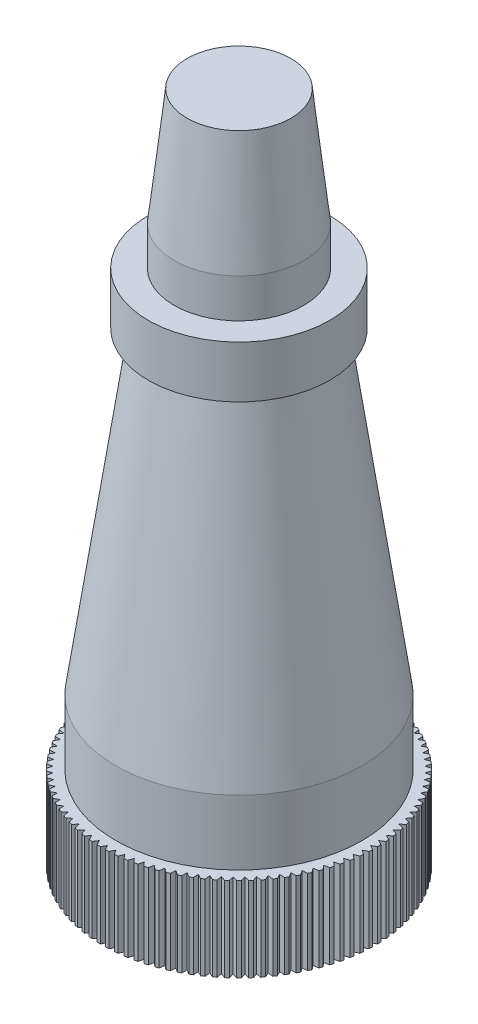
from build123d import *

# Parameters (mm, degrees)
SKETCH1_W          = 7
SKETCH1_H          = 2
CUT_EXTRUDE1_START = -10
SKETCH3_R          = 8.5
SKETCH3_R_2        = 7
CUT_EXTRUDE1_DEPTH = 10
CUT_EXTRUDE2_DEPTH = 6.5
CIRPATTERN1_COUNT  = 100


with BuildPart() as part:
    # Sketch1 → Revolve1 (revolve)
    with BuildSketch(Plane.XY):
        Polygon((0, 42), (0, 38), (6, 38), (7, 38), (7, 42), (5, 42), align=None)
        Polygon((0, 38), (0, 8.5), (9.5, 8.5), (9.5, 13.5), (6, 38), align=None)
        Polygon((0, 8.5), (0, 2), (7, 2), (10.5, 2), (10.5, 8.5), (9.5, 8.5), align=None)
        Polygon((0, 54), (0, 42), (5, 42), (5, 45), (4, 54), align=None)
        with Locations((3.5, 1)):
            Rectangle(SKETCH1_W, SKETCH1_H)
    revolve(axis=Axis((0, 2, 0), (0, 1, 0)))

    # Sketch3 → Cut-Extrude1 (cut)
    with BuildSketch(Plane.XZ.offset(CUT_EXTRUDE1_START)):
        Circle(SKETCH3_R)
        Circle(SKETCH3_R_2, mode=Mode.SUBTRACT)
    extrude(amount=CUT_EXTRUDE1_DEPTH, mode=Mode.SUBTRACT)

    # Sketch4 → Cut-Extrude2 (cut)
    with BuildSketch(Plane.XZ.offset(-2)):
        Polygon((0, 10.15), (0.375, 10.799519053), (-0.375, 10.799519053), align=None)
    cut_extrude2 = extrude(amount=-CUT_EXTRUDE2_DEPTH, mode=Mode.SUBTRACT)

    # CirPattern1: Cut-Extrude2 ×100 about axis
    cirpattern1_axis = Axis((0, 0, 0), (0, 1, 0))
    for i in range(1, CIRPATTERN1_COUNT):
        add(cut_extrude2.rotate(cirpattern1_axis, i * 360 / CIRPATTERN1_COUNT), mode=Mode.SUBTRACT)


solid = part.part
